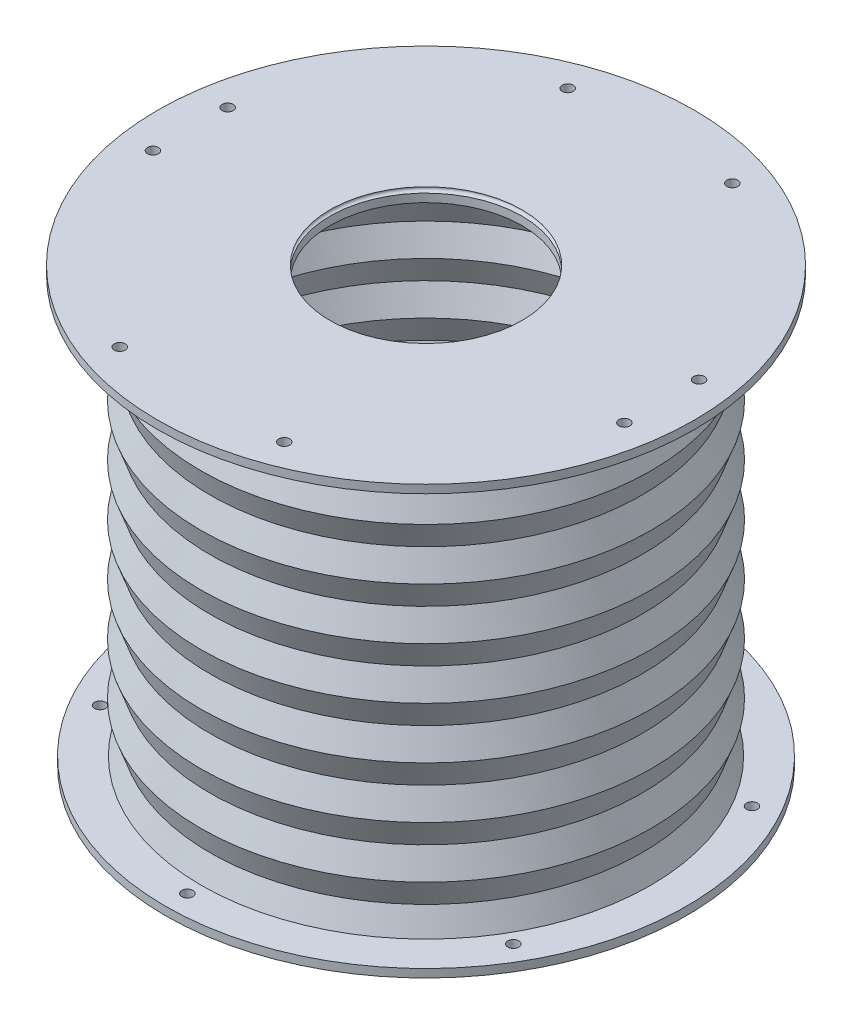
from build123d import *

# Parameters (mm, degrees)
CUT_EXTRUDE1_REACH = 211.949
SKETCH2_R          = 2
CUT_EXTRUDE2_REACH = 211.949
SKETCH3_R          = 2


with BuildPart() as part:
    # Sketch1 → Revolve4 (revolve)
    with BuildSketch(Plane.XY, mode=Mode.PRIVATE) as revolve4_sk:
        with BuildLine():
            Line((80, 1.161847476), (76.618474759, 10.572760664))
            Line((76.618474759, 10.572760664), (80, 19.983673853))
            Line((80, 19.983673853), (76.618474759, 29.394587041))
            Line((76.618474759, 29.394587041), (80, 38.80550023))
            Line((80, 38.80550023), (76.618474759, 48.216413418))
            Line((76.618474759, 48.216413418), (80, 57.627326607))
            Line((80, 57.627326607), (76.618474759, 67.038239796))
            Line((76.618474759, 67.038239796), (80, 76.449152984))
            Line((80, 76.449152984), (76.618474759, 85.860066173))
            Line((76.618474759, 85.860066173), (80, 95.270979361))
            Line((80, 95.270979361), (76.618474759, 104.68189255))
            Line((76.618474759, 104.68189255), (80, 114.092805738))
            Line((80, 114.092805738), (76.618474759, 123.503718927))
            Line((76.618474759, 123.503718927), (80, 132.914632115))
            Line((80, 132.914632115), (76.618474759, 142.325545304))
            Line((76.618474759, 142.325545304), (80, 151.736458492))
            Line((80, 151.736458492), (34.99586215, 151.736458492))
            Line((34.99586215, 151.736458492), (34.99586215, 154.736458492))
            ThreePointArc((34.99586215, 154.736458492), (35.99586215, 155.736458492), (34.99586215, 156.736458492))
            Line((34.99586215, 156.736458492), (97.843831402, 156.736458492))
            Line((97.843831402, 156.736458492), (97.843831402, 153.736458492))
            Line((97.843831402, 153.736458492), (82.843831406, 153.736458492))
            Line((82.843831406, 153.736458492), (78.743667033, 142.325545304))
            Line((78.743667033, 142.325545304), (82.125192274, 132.914632115))
            Line((82.125192274, 132.914632115), (78.743667033, 123.503718927))
            Line((78.743667033, 123.503718927), (82.125192274, 114.092805738))
            Line((82.125192274, 114.092805738), (78.743667033, 104.68189255))
            Line((78.743667033, 104.68189255), (82.125192274, 95.270979361))
            Line((82.125192274, 95.270979361), (78.743667033, 85.860066173))
            Line((78.743667033, 85.860066173), (82.125192274, 76.449152984))
            Line((82.125192274, 76.449152984), (78.743667033, 67.038239796))
            Line((78.743667033, 67.038239796), (82.125192274, 57.627326607))
            Line((82.125192274, 57.627326607), (78.743667033, 48.216413418))
            Line((78.743667033, 48.216413418), (82.125192274, 38.80550023))
            Line((82.125192274, 38.80550023), (78.743667033, 29.394587041))
            Line((78.743667033, 29.394587041), (82.125192274, 19.983673853))
            Line((82.125192274, 19.983673853), (78.743667033, 10.572760664))
            Line((78.743667033, 10.572760664), (81.882182638, 1.838152524))
            Line((81.882182638, 1.838152524), (95, 1.838152524))
            Line((95, 1.838152524), (95, -1.161847476))
            Line((95, -1.161847476), (65, -1.161847476))
            Line((65, -1.161847476), (65, 1.161847476))
            Line((65, 1.161847476), (80, 1.161847476))
        make_face()
    revolve(revolve4_sk.sketch.rotate(Axis((0, 0, 0), (0, 1, 0)), 90), axis=Axis((0, 0, 0), (0, 1, 0)))

    # Sketch2 → Cut-Extrude1 (cut, up to next)
    with BuildSketch(Plane(origin=(0, 156.736458492, 0), x_dir=(1, 0, 0), z_dir=(0, 1, 0)), mode=Mode.PRIVATE) as cut_extrude1_sk1:
        with Locations(Location((-85.928885632, 13.609798458, 0), (0, 0, 270))):
            Circle(SKETCH2_R)
    cut_extrude1_tool1 = extrude(cut_extrude1_sk1.sketch, amount=-CUT_EXTRUDE1_REACH, mode=Mode.PRIVATE) & part.part
    # Sketch2 → Cut-Extrude1 (cut, up to next)
    with BuildSketch(Plane(origin=(0, 156.736458492, 0), x_dir=(1, 0, 0), z_dir=(0, 1, 0)), mode=Mode.PRIVATE) as cut_extrude1_sk2:
        with Locations(Location((-85.928885632, -13.609798458, 0), (0, 0, 270))):
            Circle(SKETCH2_R)
    cut_extrude1_tool2 = extrude(cut_extrude1_sk2.sketch, amount=-CUT_EXTRUDE1_REACH, mode=Mode.PRIVATE) & part.part
    # Sketch2 → Cut-Extrude1 (cut, up to next)
    with BuildSketch(Plane(origin=(0, 156.736458492, 0), x_dir=(1, 0, 0), z_dir=(0, 1, 0)), mode=Mode.PRIVATE) as cut_extrude1_sk3:
        with Locations(Location((85.928885632, 13.609798458, 0), (0, 0, 270))):
            Circle(SKETCH2_R)
    cut_extrude1_tool3 = extrude(cut_extrude1_sk3.sketch, amount=-CUT_EXTRUDE1_REACH, mode=Mode.PRIVATE) & part.part
    # Sketch2 → Cut-Extrude1 (cut, up to next)
    with BuildSketch(Plane(origin=(0, 156.736458492, 0), x_dir=(1, 0, 0), z_dir=(0, 1, 0)), mode=Mode.PRIVATE) as cut_extrude1_sk4:
        with Locations(Location((85.928885632, -13.609798458, 0), (0, 0, 270))):
            Circle(SKETCH2_R)
    cut_extrude1_tool4 = extrude(cut_extrude1_sk4.sketch, amount=-CUT_EXTRUDE1_REACH, mode=Mode.PRIVATE) & part.part
    # Sketch2 → Cut-Extrude1 (cut, up to next)
    with BuildSketch(Plane(origin=(0, 156.736458492, 0), x_dir=(1, 0, 0), z_dir=(0, 1, 0)), mode=Mode.PRIVATE) as cut_extrude1_sk5:
        with Locations(Location((-30, 81.663945533, 0), (0, 0, 270))):
            Circle(SKETCH2_R)
    cut_extrude1_tool5 = extrude(cut_extrude1_sk5.sketch, amount=-CUT_EXTRUDE1_REACH, mode=Mode.PRIVATE) & part.part
    # Sketch2 → Cut-Extrude1 (cut, up to next)
    with BuildSketch(Plane(origin=(0, 156.736458492, 0), x_dir=(1, 0, 0), z_dir=(0, 1, 0)), mode=Mode.PRIVATE) as cut_extrude1_sk6:
        with Locations(Location((30, 81.663945533, 0), (0, 0, 270))):
            Circle(SKETCH2_R)
    cut_extrude1_tool6 = extrude(cut_extrude1_sk6.sketch, amount=-CUT_EXTRUDE1_REACH, mode=Mode.PRIVATE) & part.part
    # Sketch2 → Cut-Extrude1 (cut, up to next)
    with BuildSketch(Plane(origin=(0, 156.736458492, 0), x_dir=(1, 0, 0), z_dir=(0, 1, 0)), mode=Mode.PRIVATE) as cut_extrude1_sk7:
        with Locations(Location((30, -81.663945533, 0), (0, 0, 270))):
            Circle(SKETCH2_R)
    cut_extrude1_tool7 = extrude(cut_extrude1_sk7.sketch, amount=-CUT_EXTRUDE1_REACH, mode=Mode.PRIVATE) & part.part
    # Sketch2 → Cut-Extrude1 (cut, up to next)
    with BuildSketch(Plane(origin=(0, 156.736458492, 0), x_dir=(1, 0, 0), z_dir=(0, 1, 0)), mode=Mode.PRIVATE) as cut_extrude1_sk8:
        with Locations(Location((-30, -81.663945533, 0), (0, 0, 270))):
            Circle(SKETCH2_R)
    cut_extrude1_tool8 = extrude(cut_extrude1_sk8.sketch, amount=-CUT_EXTRUDE1_REACH, mode=Mode.PRIVATE) & part.part
    add(cut_extrude1_tool1.solids().sort_by_distance((-85.928886, 156.736458, -13.609798))[0], mode=Mode.SUBTRACT)
    add(cut_extrude1_tool2.solids().sort_by_distance((-85.928886, 156.736458, 13.609798))[0], mode=Mode.SUBTRACT)
    add(cut_extrude1_tool3.solids().sort_by_distance((85.928886, 156.736458, -13.609798))[0], mode=Mode.SUBTRACT)
    add(cut_extrude1_tool4.solids().sort_by_distance((85.928886, 156.736458, 13.609798))[0], mode=Mode.SUBTRACT)
    add(cut_extrude1_tool5.solids().sort_by_distance((-30, 156.736458, -81.663946))[0], mode=Mode.SUBTRACT)
    add(cut_extrude1_tool6.solids().sort_by_distance((30, 156.736458, -81.663946))[0], mode=Mode.SUBTRACT)
    add(cut_extrude1_tool7.solids().sort_by_distance((30, 156.736458, 81.663946))[0], mode=Mode.SUBTRACT)
    add(cut_extrude1_tool8.solids().sort_by_distance((-30, 156.736458, 81.663946))[0], mode=Mode.SUBTRACT)

    # Sketch3 → Cut-Extrude2 (cut, up to next)
    with BuildSketch(Plane.XZ.offset(1.161847476), mode=Mode.PRIVATE) as cut_extrude2_sk1:
        with Locations(Location((0, 87, 0), (0, 0, 270))):
            Circle(SKETCH3_R)
    cut_extrude2_tool1 = extrude(cut_extrude2_sk1.sketch, amount=-CUT_EXTRUDE2_REACH, mode=Mode.PRIVATE) & part.part
    # Sketch3 → Cut-Extrude2 (cut, up to next)
    with BuildSketch(Plane.XZ.offset(1.161847476), mode=Mode.PRIVATE) as cut_extrude2_sk2:
        with Locations(Location((75.344210129, 43.5, 0), (0, 0, 270))):
            Circle(SKETCH3_R)
    cut_extrude2_tool2 = extrude(cut_extrude2_sk2.sketch, amount=-CUT_EXTRUDE2_REACH, mode=Mode.PRIVATE) & part.part
    # Sketch3 → Cut-Extrude2 (cut, up to next)
    with BuildSketch(Plane.XZ.offset(1.161847476), mode=Mode.PRIVATE) as cut_extrude2_sk3:
        with Locations(Location((75.344210129, -43.5, 0), (0, 0, 270))):
            Circle(SKETCH3_R)
    cut_extrude2_tool3 = extrude(cut_extrude2_sk3.sketch, amount=-CUT_EXTRUDE2_REACH, mode=Mode.PRIVATE) & part.part
    # Sketch3 → Cut-Extrude2 (cut, up to next)
    with BuildSketch(Plane.XZ.offset(1.161847476), mode=Mode.PRIVATE) as cut_extrude2_sk4:
        with Locations(Location((0, -87, 0), (0, 0, 270))):
            Circle(SKETCH3_R)
    cut_extrude2_tool4 = extrude(cut_extrude2_sk4.sketch, amount=-CUT_EXTRUDE2_REACH, mode=Mode.PRIVATE) & part.part
    # Sketch3 → Cut-Extrude2 (cut, up to next)
    with BuildSketch(Plane.XZ.offset(1.161847476), mode=Mode.PRIVATE) as cut_extrude2_sk5:
        with Locations(Location((-75.344210129, -43.5, 0), (0, 0, 270))):
            Circle(SKETCH3_R)
    cut_extrude2_tool5 = extrude(cut_extrude2_sk5.sketch, amount=-CUT_EXTRUDE2_REACH, mode=Mode.PRIVATE) & part.part
    # Sketch3 → Cut-Extrude2 (cut, up to next)
    with BuildSketch(Plane.XZ.offset(1.161847476), mode=Mode.PRIVATE) as cut_extrude2_sk6:
        with Locations(Location((-75.344210129, 43.5, 0), (0, 0, 270))):
            Circle(SKETCH3_R)
    cut_extrude2_tool6 = extrude(cut_extrude2_sk6.sketch, amount=-CUT_EXTRUDE2_REACH, mode=Mode.PRIVATE) & part.part
    add(cut_extrude2_tool1.solids().sort_by_distance((0, -1.161847, 87))[0], mode=Mode.SUBTRACT)
    add(cut_extrude2_tool2.solids().sort_by_distance((75.34421, -1.161847, 43.5))[0], mode=Mode.SUBTRACT)
    add(cut_extrude2_tool3.solids().sort_by_distance((75.34421, -1.161847, -43.5))[0], mode=Mode.SUBTRACT)
    add(cut_extrude2_tool4.solids().sort_by_distance((0, -1.161847, -87))[0], mode=Mode.SUBTRACT)
    add(cut_extrude2_tool5.solids().sort_by_distance((-75.34421, -1.161847, -43.5))[0], mode=Mode.SUBTRACT)
    add(cut_extrude2_tool6.solids().sort_by_distance((-75.34421, -1.161847, 43.5))[0], mode=Mode.SUBTRACT)


solid = part.part
